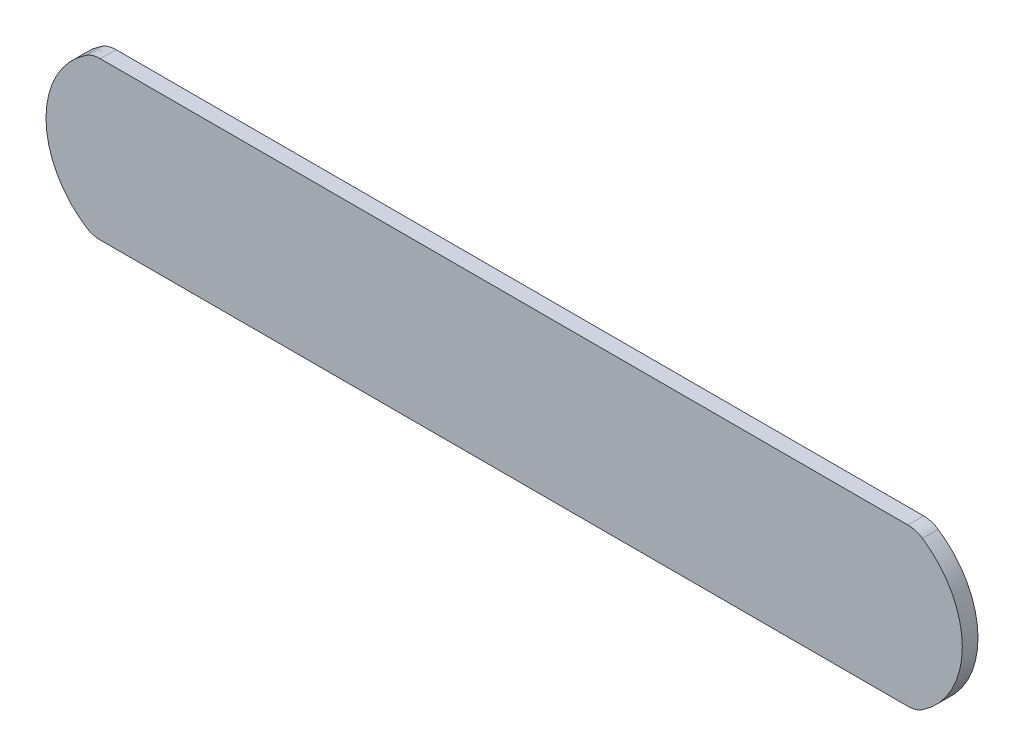
from build123d import *

# Parameters (mm, degrees)
SALIENTE_EXTRUIR1_DEPTH = 3


with BuildPart() as part:
    # Croquis1 → Saliente-Extruir1 (new body)
    with BuildSketch(Plane.XY):
        with BuildLine():
            Line((77.13407836, 15), (-77.13407836, 15))
            add(Edge.make_bspline(
                [(-77.13407836, 15), (-77.871262638, 15), (-78.576496818, 14.787307583), (-79.282235227, 14.574463094), (-79.896125243, 14.167315569)],
                knots=[0, 0, 0, 0.5, 0.5, 1, 1, 1], degree=2))
            ThreePointArc((-79.896125243, 14.167315569), (-87.5, 0), (-79.896125243, -14.167315569))
            add(Edge.make_bspline(
                [(-79.896125243, -14.167315569), (-79.281776873, -14.574767086), (-78.576496886, -14.787307562), (-77.870712638, -15), (-77.13407836, -15)],
                knots=[0, 0, 0, 0.5, 0.5, 1, 1, 1], degree=2))
            Line((-77.13407836, -15), (77.13407836, -15))
            add(Edge.make_bspline(
                [(77.13407836, -15), (77.871262638, -15), (78.576496818, -14.787307583), (79.282235227, -14.574463094), (79.896125243, -14.167315569)],
                knots=[0, 0, 0, 0.5, 0.5, 1, 1, 1], degree=2))
            ThreePointArc((79.896125243, -14.167315569), (87.5, 0), (79.896125243, 14.167315569))
            add(Edge.make_bspline(
                [(79.896125243, 14.167315569), (79.281776873, 14.574767086), (78.576496886, 14.787307562), (77.870712638, 15), (77.13407836, 15)],
                knots=[0, 0, 0, 0.5, 0.5, 1, 1, 1], degree=2))
        make_face()
    extrude(amount=SALIENTE_EXTRUIR1_DEPTH)


solid = part.part
